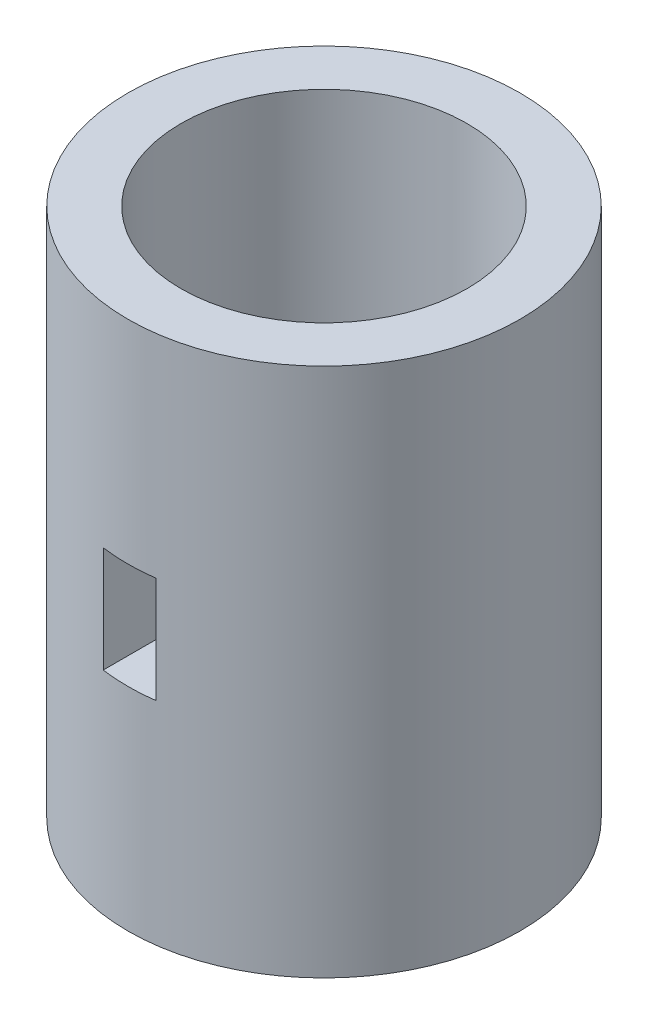
from build123d import *

# Parameters (mm, degrees)
SKETCH_1_R          = 3700
EXTRUDE_1_DEPTH     = 1000
SKETCH_2_R          = 3700
SKETCH_2_R_2        = 2700
EXTRUDE_2_DEPTH     = 9000
SKETCH_4_W          = 1000
SKETCH_4_H          = 1046.700167716
CUT_EXTRUDE_2_DEPTH = 2000
SKETCH_3_W          = 1043.332473871
SKETCH_3_H          = 1000
CUT_EXTRUDE_1_DEPTH = 2200


with BuildPart() as part:
    # ｽｹｯﾁ1 → ﾎﾞｽ - 押し出し1 (new body)
    with BuildSketch(Plane(origin=(0, 0, 0), x_dir=(1, 0, 0), z_dir=(0, 1, 0))):
        Circle(SKETCH_1_R)
    extrude(amount=EXTRUDE_1_DEPTH)

    # ｽｹｯﾁ2 → ﾎﾞｽ - 押し出し2 (add)
    with BuildSketch(Plane(origin=(0, 1000, 0), x_dir=(1, 0, 0), z_dir=(0, 1, 0))):
        Circle(SKETCH_2_R)
        Circle(SKETCH_2_R_2, mode=Mode.SUBTRACT)
    extrude(amount=EXTRUDE_2_DEPTH)

    # ｽｹｯﾁ4 → ｶｯﾄ - 押し出し2 (cut)
    with BuildSketch(Plane(origin=(0, 4000, 0), x_dir=(1, 0, 0), z_dir=(0, 1, 0))):
        with Locations((0, -3176.649916142)):
            Rectangle(SKETCH_4_W, SKETCH_4_H)
    extrude(amount=CUT_EXTRUDE_2_DEPTH, mode=Mode.SUBTRACT)

    # ｽｹｯﾁ3 → ｶｯﾄ - 押し出し1 (cut)
    with BuildSketch(Plane(origin=(0, 1000, 0), x_dir=(1, 0, 0), z_dir=(0, 1, 0))):
        with Locations((-3178.333763065, -18.214097747)):
            Rectangle(SKETCH_3_W, SKETCH_3_H)
    extrude(amount=CUT_EXTRUDE_1_DEPTH, mode=Mode.SUBTRACT)


solid = part.part
